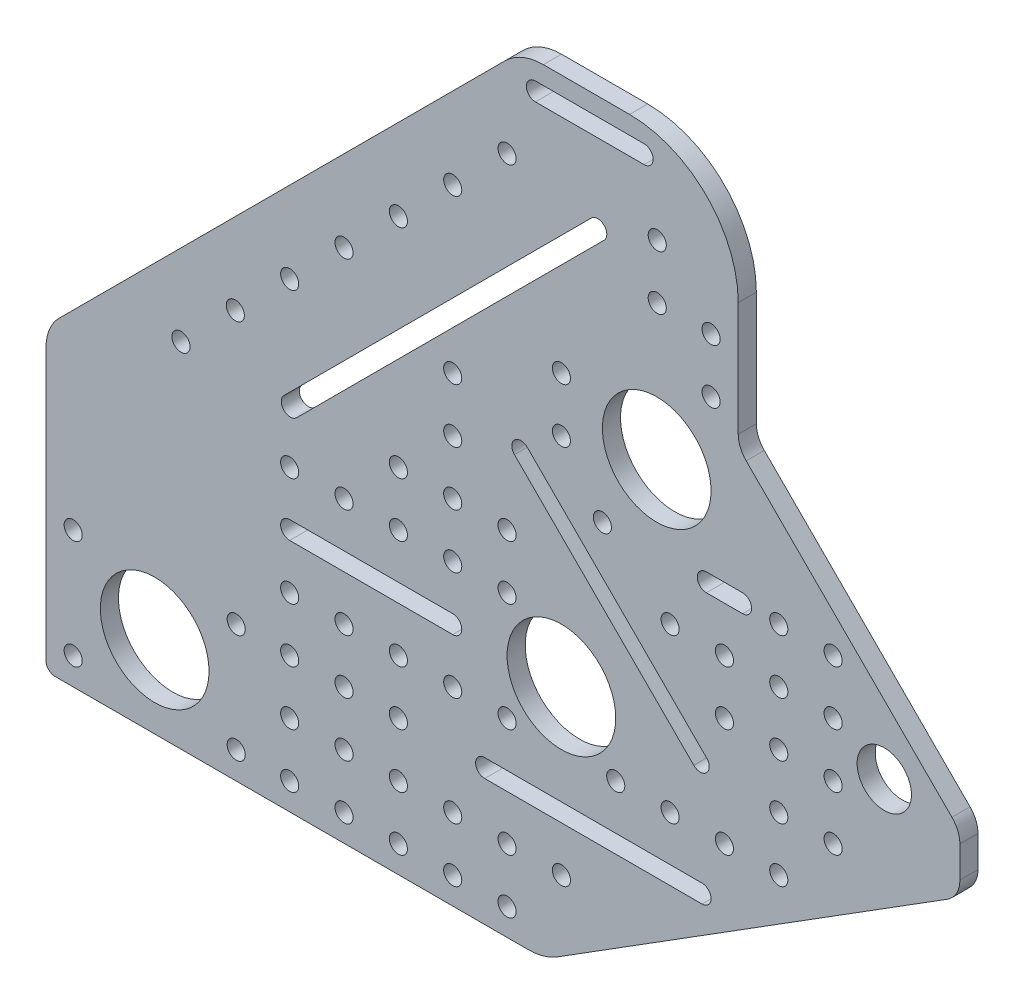
from build123d import *

# Parameters (mm, degrees)
MODEL_R                 = 1.5
MODEL_R_2               = 9
MODEL_R_3               = 4.5
SALIENTE_EXTRUIR1_DEPTH = 3


with BuildPart() as part:
    # Model → Saliente-Extruir1 (new body)
    with BuildSketch(Plane.XY):
        with BuildLine():
            Line((-509.173691468, 701.09903587), (-523.445769407, 701.09903587))
            ThreePointArc((-523.445769407, 701.09903587), (-526.889920298, 700.413951663), (-529.809730437, 698.462996901))
            Line((-529.809730437, 698.462996901), (-603.519329352, 624.753397987))
            ThreePointArc((-603.519329352, 624.753397987), (-605.217350164, 622.286969974), (-605.815119618, 619.352823846))
            Line((-605.815119618, 619.352823846), (-605.815119618, 574.412726468))
            ThreePointArc((-605.815119618, 574.412726468), (-605.37577979, 573.352066296), (-604.315119618, 572.912726468))
            Line((-604.315119618, 572.912726468), (-525.906943381, 572.912726468))
            ThreePointArc((-525.906943381, 572.912726468), (-523.416339106, 573.264206922), (-521.120267881, 574.29119528))
            Line((-521.120267881, 574.29119528), (-456.573677169, 614.829451541))
            ThreePointArc((-456.573677169, 614.829451541), (-455.028739924, 616.463065312), (-454.467014919, 618.640217135))
            Line((-454.467014919, 618.640217135), (-454.467014919, 623.805510673))
            ThreePointArc((-454.467014919, 623.805510673), (-454.809557023, 625.527586118), (-455.785034404, 626.987491188))
            Line((-455.785034404, 626.987491188), (-489.855671983, 661.058128768))
            ThreePointArc((-489.855671983, 661.058128768), (-490.831149364, 662.518033837), (-491.173691468, 664.240109283))
            Line((-491.173691468, 664.240109283), (-491.173691468, 683.09903587))
            ThreePointArc((-491.173691468, 683.09903587), (-496.445769407, 695.826957932), (-509.173691468, 701.09903587))
        make_face()
        with Locations((-601.315119618, 577.412726468)):
            Circle(MODEL_R, mode=Mode.SUBTRACT)
        with Locations((-587.815119618, 586.412726468)):
            Circle(MODEL_R_2, mode=Mode.SUBTRACT)
        with Locations((-574.315119618, 577.412726468)):
            Circle(MODEL_R, mode=Mode.SUBTRACT)
        with Locations((-601.315119618, 595.412726468)):
            Circle(MODEL_R, mode=Mode.SUBTRACT)
        with Locations((-574.315119618, 595.412726468)):
            Circle(MODEL_R, mode=Mode.SUBTRACT)
        with Locations((-565.459568289, 577.351847961)):
            Circle(MODEL_R, mode=Mode.SUBTRACT)
        with Locations((-556.459568289, 577.351847961)):
            Circle(MODEL_R, mode=Mode.SUBTRACT)
        with Locations((-565.459568289, 586.351847961)):
            Circle(MODEL_R, mode=Mode.SUBTRACT)
        with Locations((-556.459568289, 586.351847961)):
            Circle(MODEL_R, mode=Mode.SUBTRACT)
        with Locations((-547.459568289, 577.351847961)):
            Circle(MODEL_R, mode=Mode.SUBTRACT)
        with Locations((-538.459568289, 577.351847961)):
            Circle(MODEL_R, mode=Mode.SUBTRACT)
        with Locations((-547.459568289, 586.351847961)):
            Circle(MODEL_R, mode=Mode.SUBTRACT)
        with Locations((-538.459568289, 586.351847961)):
            Circle(MODEL_R, mode=Mode.SUBTRACT)
        with Locations((-565.459568289, 595.351847961)):
            Circle(MODEL_R, mode=Mode.SUBTRACT)
        with Locations((-556.459568289, 595.351847961)):
            Circle(MODEL_R, mode=Mode.SUBTRACT)
        with Locations((-565.459568289, 604.351847961)):
            Circle(MODEL_R, mode=Mode.SUBTRACT)
        with Locations((-556.459568289, 604.351847961)):
            Circle(MODEL_R, mode=Mode.SUBTRACT)
        with Locations((-547.459568289, 595.351847961)):
            Circle(MODEL_R, mode=Mode.SUBTRACT)
        with Locations((-547.459568289, 604.351847961)):
            Circle(MODEL_R, mode=Mode.SUBTRACT)
        with Locations((-538.459568289, 604.351847961)):
            Circle(MODEL_R, mode=Mode.SUBTRACT)
        with Locations((-583.459568289, 631.351847961)):
            Circle(MODEL_R, mode=Mode.SUBTRACT)
        with BuildLine():
            ThreePointArc((-565.459568289, 611.851847961), (-566.959568289, 613.351847961), (-565.459568289, 614.851847961))
            Line((-565.459568289, 614.851847961), (-538.459568289, 614.851847961))
            ThreePointArc((-538.459568289, 614.851847961), (-536.959568289, 613.351847961), (-538.459568289, 611.851847961))
            Line((-538.459568289, 611.851847961), (-565.459568289, 611.851847961))
        make_face(mode=Mode.SUBTRACT)
        with Locations((-565.459568289, 622.351847961)):
            Circle(MODEL_R, mode=Mode.SUBTRACT)
        with Locations((-556.459568289, 622.351847961)):
            Circle(MODEL_R, mode=Mode.SUBTRACT)
        with Locations((-547.459568289, 622.351847961)):
            Circle(MODEL_R, mode=Mode.SUBTRACT)
        with Locations((-538.459568289, 622.351847961)):
            Circle(MODEL_R, mode=Mode.SUBTRACT)
        with Locations((-547.459568289, 631.351847961)):
            Circle(MODEL_R, mode=Mode.SUBTRACT)
        with Locations((-538.459568289, 631.351847961)):
            Circle(MODEL_R, mode=Mode.SUBTRACT)
        with Locations((-529.459568289, 577.351847961)):
            Circle(MODEL_R, mode=Mode.SUBTRACT)
        with Locations((-529.459568289, 586.351847961)):
            Circle(MODEL_R, mode=Mode.SUBTRACT)
        with Locations((-520.459568289, 586.351847961)):
            Circle(MODEL_R, mode=Mode.SUBTRACT)
        with BuildLine():
            ThreePointArc((-533.170047289, 593.851847961), (-534.670047289, 595.351847961), (-533.170047289, 596.851847961))
            Line((-533.170047289, 596.851847961), (-497.173691468, 596.851847961))
            ThreePointArc((-497.173691468, 596.851847961), (-495.673691468, 595.351847961), (-497.173691468, 593.851847961))
            Line((-497.173691468, 593.851847961), (-533.170047289, 593.851847961))
        make_face(mode=Mode.SUBTRACT)
        with Locations((-529.459568289, 604.351847961)):
            Circle(MODEL_R, mode=Mode.SUBTRACT)
        with Locations((-511.459568289, 604.351847961)):
            Circle(MODEL_R, mode=Mode.SUBTRACT)
        with Locations((-502.459568289, 604.351847961)):
            Circle(MODEL_R, mode=Mode.SUBTRACT)
        with Locations((-493.459568289, 604.351847961)):
            Circle(MODEL_R, mode=Mode.SUBTRACT)
        with Locations((-484.459568289, 604.351847961)):
            Circle(MODEL_R, mode=Mode.SUBTRACT)
        with Locations((-520.459568289, 613.351847961)):
            Circle(MODEL_R_2, mode=Mode.SUBTRACT)
        with Locations((-529.459568289, 622.351847961)):
            Circle(MODEL_R, mode=Mode.SUBTRACT)
        with BuildLine():
            Line((-526.113031296, 644.884046766), (-496.414546486, 615.185561956))
            ThreePointArc((-496.414546486, 615.185561956), (-496.414546486, 613.064241613), (-498.53586683, 613.064241613))
            Line((-498.53586683, 613.064241613), (-528.23435164, 642.762726422))
            ThreePointArc((-528.23435164, 642.762726422), (-528.23435164, 644.884046766), (-526.113031296, 644.884046766))
        make_face(mode=Mode.SUBTRACT)
        with Locations((-529.459568289, 631.351847961)):
            Circle(MODEL_R, mode=Mode.SUBTRACT)
        with Locations((-493.459568289, 622.351847961)):
            Circle(MODEL_R, mode=Mode.SUBTRACT)
        with Locations((-502.459568289, 631.351847961)):
            Circle(MODEL_R, mode=Mode.SUBTRACT)
        with Locations((-493.459568289, 631.351847961)):
            Circle(MODEL_R, mode=Mode.SUBTRACT)
        with Locations((-484.459568289, 613.351847961)):
            Circle(MODEL_R, mode=Mode.SUBTRACT)
        with Locations((-475.459568289, 613.351847961)):
            Circle(MODEL_R, mode=Mode.SUBTRACT)
        with Locations((-484.459568289, 622.351847961)):
            Circle(MODEL_R, mode=Mode.SUBTRACT)
        with Locations((-475.459568289, 622.351847961)):
            Circle(MODEL_R, mode=Mode.SUBTRACT)
        with Locations((-484.459568289, 631.351847961)):
            Circle(MODEL_R, mode=Mode.SUBTRACT)
        with Locations((-475.459568289, 631.351847961)):
            Circle(MODEL_R, mode=Mode.SUBTRACT)
        with Locations((-466.989899424, 626.851847961)):
            Circle(MODEL_R_3, mode=Mode.SUBTRACT)
        with Locations((-574.459568289, 640.351847961)):
            Circle(MODEL_R, mode=Mode.SUBTRACT)
        with Locations((-565.459568289, 649.351847961)):
            Circle(MODEL_R, mode=Mode.SUBTRACT)
        with Locations((-538.459568289, 640.351847961)):
            Circle(MODEL_R, mode=Mode.SUBTRACT)
        with Locations((-538.459568289, 649.351847961)):
            Circle(MODEL_R, mode=Mode.SUBTRACT)
        with Locations((-556.459568289, 658.351847961)):
            Circle(MODEL_R, mode=Mode.SUBTRACT)
        with BuildLine():
            Line((-566.418117824, 632.156124705), (-515.506429579, 683.06781295))
            ThreePointArc((-515.506429579, 683.06781295), (-513.385109235, 683.06781295), (-513.385109235, 680.946492606))
            Line((-513.385109235, 680.946492606), (-564.29679748, 630.034804361))
            ThreePointArc((-564.29679748, 630.034804361), (-566.418117824, 630.034804361), (-566.418117824, 632.156124705))
        make_face(mode=Mode.SUBTRACT)
        with Locations((-547.459568289, 667.351847961)):
            Circle(MODEL_R, mode=Mode.SUBTRACT)
        with Locations((-538.459568289, 676.351847961)):
            Circle(MODEL_R, mode=Mode.SUBTRACT)
        with Locations((-513.673691468, 640.351847961)):
            Circle(MODEL_R, mode=Mode.SUBTRACT)
        with Locations((-520.459568289, 649.351847961)):
            Circle(MODEL_R, mode=Mode.SUBTRACT)
        with BuildLine():
            ThreePointArc((-496.459568289, 638.851847961), (-497.959568289, 640.351847961), (-496.459568289, 641.851847961))
            Line((-496.459568289, 641.851847961), (-490.459568289, 641.851847961))
            ThreePointArc((-490.459568289, 641.851847961), (-488.959568289, 640.351847961), (-490.459568289, 638.851847961))
            Line((-490.459568289, 638.851847961), (-496.459568289, 638.851847961))
        make_face(mode=Mode.SUBTRACT)
        with Locations((-520.459568289, 658.351847961)):
            Circle(MODEL_R, mode=Mode.SUBTRACT)
        with Locations((-504.673691468, 653.851847961)):
            Circle(MODEL_R_2, mode=Mode.SUBTRACT)
        with Locations((-495.673691468, 667.351847961)):
            Circle(MODEL_R, mode=Mode.SUBTRACT)
        with Locations((-484.459568289, 640.351847961)):
            Circle(MODEL_R, mode=Mode.SUBTRACT)
        with Locations((-475.459568289, 640.351847961)):
            Circle(MODEL_R, mode=Mode.SUBTRACT)
        with Locations((-504.588556274, 676.351847961)):
            Circle(MODEL_R, mode=Mode.SUBTRACT)
        with Locations((-495.673691468, 676.351847961)):
            Circle(MODEL_R, mode=Mode.SUBTRACT)
        with Locations((-529.459568289, 685.351847961)):
            Circle(MODEL_R, mode=Mode.SUBTRACT)
        with BuildLine():
            Line((-524.763788891, 698.09903587), (-506.763788891, 698.09903587))
            ThreePointArc((-506.763788891, 698.09903587), (-505.263788891, 696.59903587), (-506.763788891, 695.09903587))
            Line((-506.763788891, 695.09903587), (-524.763788891, 695.09903587))
            ThreePointArc((-524.763788891, 695.09903587), (-526.263788891, 696.59903587), (-524.763788891, 698.09903587))
        make_face(mode=Mode.SUBTRACT)
        with Locations((-504.588556274, 685.351847961)):
            Circle(MODEL_R, mode=Mode.SUBTRACT)
    extrude(amount=SALIENTE_EXTRUIR1_DEPTH)


solid = part.part
